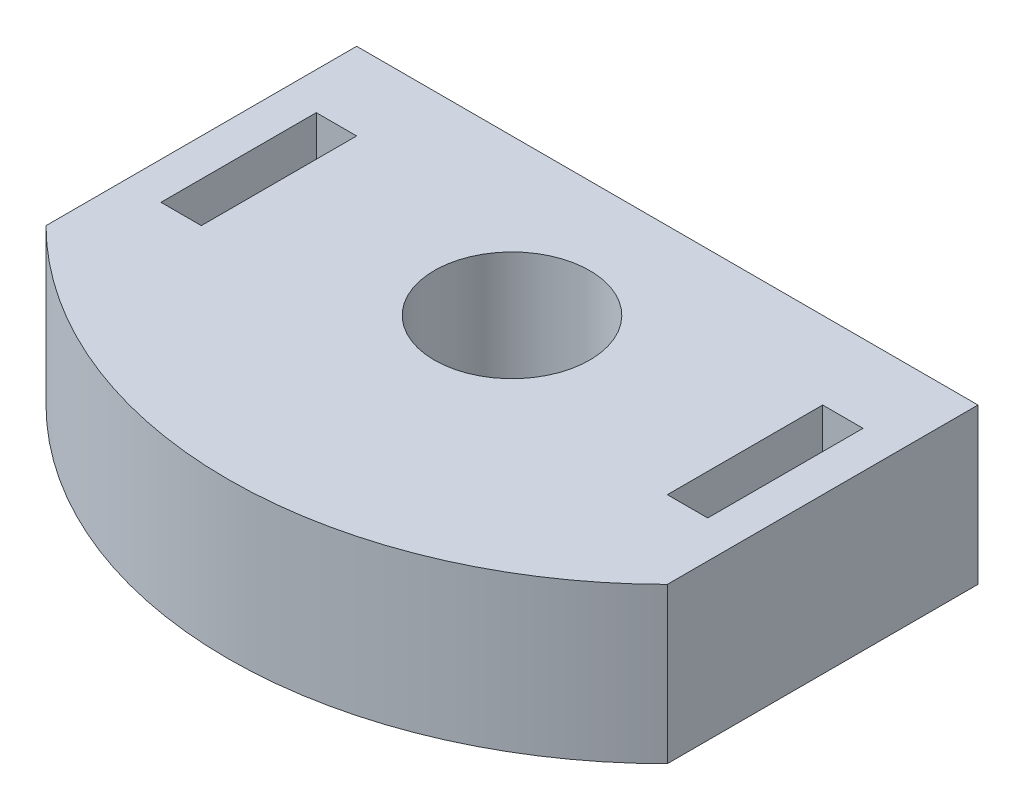
from build123d import *

# Parameters (mm, degrees)
SKETCH1_W           = 40
SKETCH1_H           = 20
SKETCH1_R           = 5
SKETCH1_W_2         = 2.6
SKETCH1_H_2         = 10
BOSS_EXTRUDE1_DEPTH = 10


with BuildPart() as part:
    # Sketch1 → Boss-Extrude1 (new body)
    # profile 1 of 2: a face of its own
    with BuildSketch(Plane(origin=(0, 0, 0), x_dir=(1, 0, 0), z_dir=(0, 1, 0))):
        Rectangle(SKETCH1_W, SKETCH1_H)
        with Locations(Location((0, 0, 0), (0, 0, 270))):
            Circle(SKETCH1_R, mode=Mode.SUBTRACT)
        with Locations((16.3, 0)):
            Rectangle(SKETCH1_W_2, SKETCH1_H_2, mode=Mode.SUBTRACT)
        with Locations((-16.3, 0)):
            Rectangle(SKETCH1_W_2, SKETCH1_H_2, mode=Mode.SUBTRACT)
    # profile 2 of 2: a face of its own
    with BuildSketch(Plane(origin=(0, 0, 0), x_dir=(1, 0, 0), z_dir=(0, 1, 0))):
        with BuildLine():
            Line((-20, -10), (20, -10))
            ThreePointArc((20, -10), (0, -18.284271247), (-20, -10))
        make_face()
    extrude(amount=BOSS_EXTRUDE1_DEPTH)


solid = part.part
